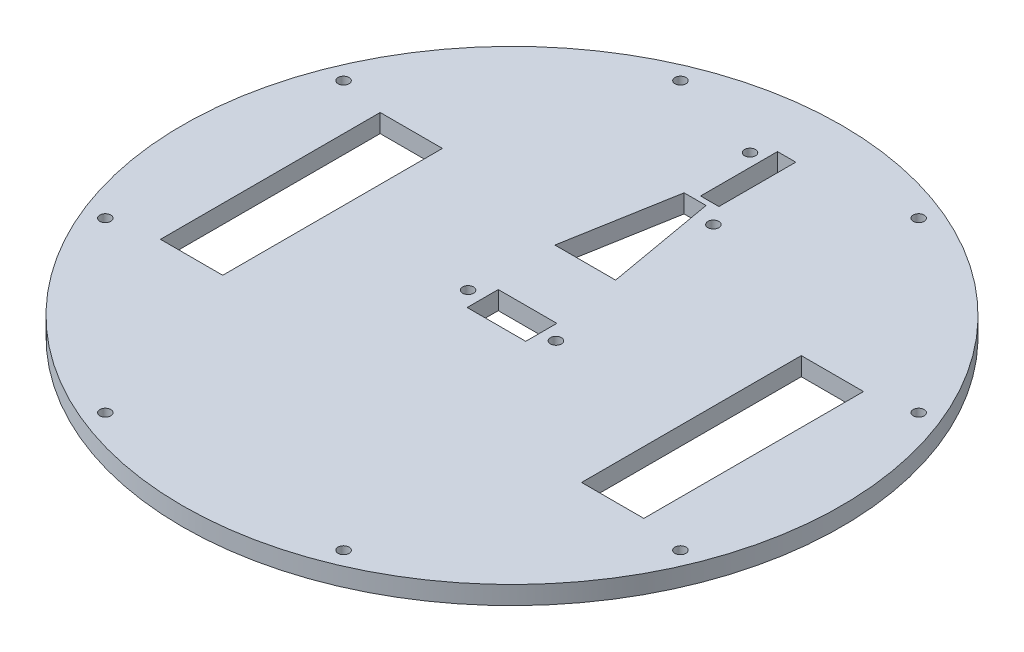
from build123d import *

# Parameters (mm, degrees)
SKETCH1_R           = 90
SKETCH1_R_2         = 1.5
SKETCH1_W           = 17
SKETCH1_H           = 60
SKETCH1_W_2         = 5
SKETCH1_H_2         = 21
BOSS_EXTRUDE1_DEPTH = 5
SKETCH3_R           = 1.5
OUTER_SCREWS_DEPTH  = 10
SKETCH2_R           = 1.5
SKETCH2_W           = 16
SKETCH2_H           = 8.5
SAFETY_LINK_DEPTH   = 10


with BuildPart() as part:
    # Sketch1 → Boss-Extrude1 (new body)
    with BuildSketch(Plane(origin=(0, 0, 0), x_dir=(1, 0, 0), z_dir=(0, 1, 0))):
        with Locations(Location((0, 0, 0), (0, 0, 270))):
            Circle(SKETCH1_R)
        with Locations(Location((-6, 71, 0), (0, 0, 270))):
            Circle(SKETCH1_R_2, mode=Mode.SUBTRACT)
        with Locations(Location((6, 49, 0), (0, 0, 270))):
            Circle(SKETCH1_R_2, mode=Mode.SUBTRACT)
        with Locations((-57.5, 0)):
            Rectangle(SKETCH1_W, SKETCH1_H, mode=Mode.SUBTRACT)
        with Locations((57.5, 0)):
            Rectangle(SKETCH1_W, SKETCH1_H, mode=Mode.SUBTRACT)
        with Locations((0, 64.5)):
            Rectangle(SKETCH1_W_2, SKETCH1_H_2, mode=Mode.SUBTRACT)
        Polygon((-5.5, 52.5), (0.5, 52.5), (5.789809421, 22.5), (-10.789809421, 22.5), align=None, mode=Mode.SUBTRACT)
    extrude(amount=BOSS_EXTRUDE1_DEPTH)

    # Sketch3 → Outer Screws (cut)
    with BuildSketch(Plane(origin=(0, 5, 0), x_dir=(1, 0, 0), z_dir=(0, 1, 0))):
        with Locations(Location((32.528091751, 78.529760263, 0), (0, 0, 270))):
            Circle(SKETCH3_R)
        with Locations(Location((78.529760263, 32.528091751, 0), (0, 0, 270))):
            Circle(SKETCH3_R)
        with Locations(Location((78.529760263, -32.528091751, 0), (0, 0, 270))):
            Circle(SKETCH3_R)
        with Locations(Location((32.528091751, -78.529760263, 0), (0, 0, 270))):
            Circle(SKETCH3_R)
        with Locations(Location((-32.528091751, -78.529760263, 0), (0, 0, 270))):
            Circle(SKETCH3_R)
        with Locations(Location((-78.529760263, -32.528091751, 0), (0, 0, 270))):
            Circle(SKETCH3_R)
        with Locations(Location((-78.529760263, 32.528091751, 0), (0, 0, 270))):
            Circle(SKETCH3_R)
        with Locations(Location((-32.528091751, 78.529760263, 0), (0, 0, 270))):
            Circle(SKETCH3_R)
    extrude(amount=-OUTER_SCREWS_DEPTH, mode=Mode.SUBTRACT)

    # Sketch2 → Safety Link (cut)
    with BuildSketch(Plane(origin=(0, 5, 0), x_dir=(1, 0, 0), z_dir=(0, 1, 0))):
        with Locations(Location((-12, 0, 0), (0, 0, 270))):
            Circle(SKETCH2_R)
        with Locations(Location((12, 0, 0), (0, 0, 270))):
            Circle(SKETCH2_R)
        Rectangle(SKETCH2_W, SKETCH2_H)
    extrude(amount=-SAFETY_LINK_DEPTH, mode=Mode.SUBTRACT)


solid = part.part
